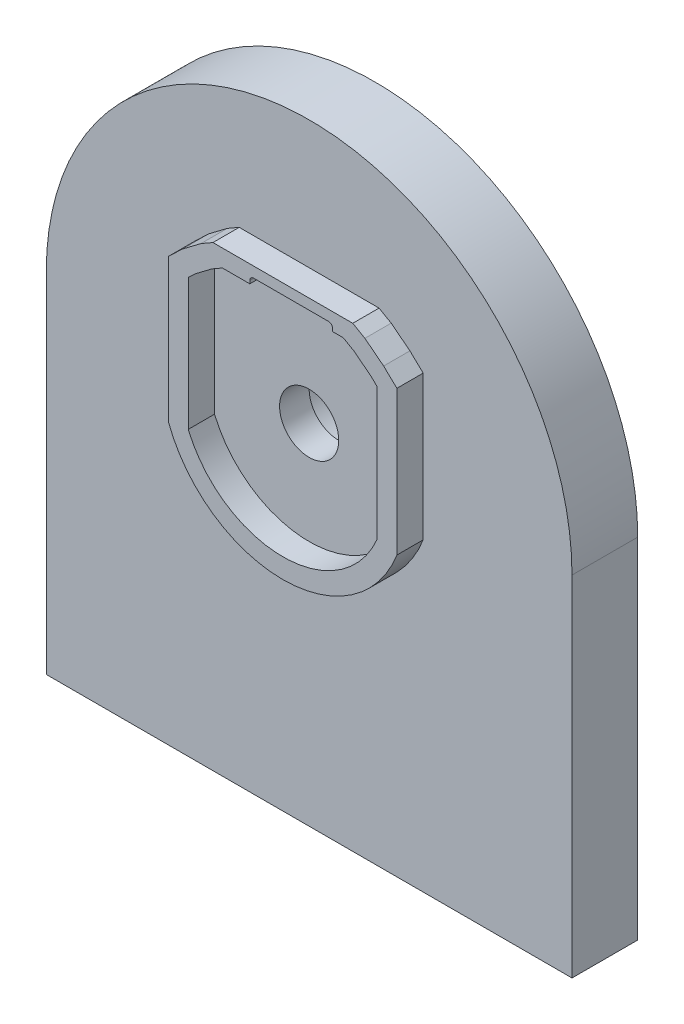
from build123d import *

# Parameters (mm, degrees)
SKETCH6_W           = 80
SKETCH6_H           = 106.2
BOSS_EXTRUDE3_DEPTH = 5
BOSS_EXTRUDE2_DEPTH = 4
CUT_EXTRUDE2_REACH  = 69.228
SKETCH4_R           = 4.5
SKETCH7_R           = 7.75
CUT_EXTRUDE3_DEPTH  = 5.5
CUT_EXTRUDE4_START  = -5
CUT_EXTRUDE4_DEPTH  = 10


with BuildPart() as part:
    # Sketch6 → Boss-Extrude3 (new, symmetric)
    with BuildSketch(Plane.XY):
        Rectangle(SKETCH6_W, SKETCH6_H)
    extrude(amount=BOSS_EXTRUDE3_DEPTH, both=True)

    # Sketch3 → Boss-Extrude2 (add)
    with BuildSketch(Plane.XY.offset(5)):
        with BuildLine():
            Line((-17.395287132, -6.571810208), (-17.395287132, 15.307157848))
            Line((-17.395287132, 15.307157848), (-15.311099774, 17.296395792))
            Line((-15.311099774, 17.296395792), (-12.46185448, 19.451424939))
            Line((-12.46185448, 19.451424939), (-10.63935497, 20.5))
            Line((-10.63935497, 20.5), (10.639354967, 20.5))
            Line((10.639354967, 20.5), (12.481546734, 19.440095002))
            Line((12.481546734, 19.440095002), (15.334663563, 17.215949154))
            Line((15.334663563, 17.215949154), (17.351649475, 15.287999429))
            Line((17.351649475, 15.287999429), (17.351649475, -6.686177108))
            ThreePointArc((17.351649475, -6.686177108), (-0.061204642, -18.595186415), (-17.395287132, -6.571810208))
        make_face()
        with BuildLine():
            Line((-14.395287132, -5.999057373), (-14.395287132, 14.02336094))
            Line((-14.395287132, 14.02336094), (-13.364210648, 15.007464628))
            Line((-13.364210648, 15.007464628), (-10.802429685, 16.945069879))
            Line((-10.802429685, 16.945069879), (-9.202356052, 17.865672216))
            Line((-9.202356052, 17.865672216), (-5.025287127, 17.865672216))
            Line((-5.025287127, 17.865672216), (-5.025287127, 18.307908255))
            ThreePointArc((-5.025287127, 18.307908255), (-4.850962964, 18.728764013), (-4.430107206, 18.903088176))
            Line((-4.430107206, 18.903088176), (6.970107208, 18.903088176))
            ThreePointArc((6.970107208, 18.903088176), (7.390962965, 18.728764013), (7.565287128, 18.307908255))
            Line((7.565287128, 18.307908255), (7.565287128, 17.865672216))
            Line((7.565287128, 17.865672216), (9.202356049, 17.865672216))
            Line((9.202356049, 17.865672216), (10.803064919, 16.944704398))
            Line((10.803064919, 16.944704398), (13.37101734, 14.942858327))
            Line((13.37101734, 14.942858327), (14.351649475, 14.00551442))
            Line((14.351649475, 14.00551442), (14.351649475, -6.102715652))
            ThreePointArc((14.351649475, -6.102715652), (-0.056234518, -15.595185752), (-14.395287132, -5.999057373))
        make_face(mode=Mode.SUBTRACT)
    extrude(amount=BOSS_EXTRUDE2_DEPTH)

    # Sketch4 → Cut-Extrude2 (cut, up to next)
    with BuildSketch(Plane.XY.offset(5), mode=Mode.PRIVATE) as cut_extrude2_sk1:
        Circle(SKETCH4_R)
    cut_extrude2_tool1 = extrude(cut_extrude2_sk1.sketch, amount=-CUT_EXTRUDE2_REACH, mode=Mode.PRIVATE) & part.part
    add(cut_extrude2_tool1.solids().sort_by_distance((0, 0, 5))[0], mode=Mode.SUBTRACT)

    # Sketch7 → Cut-Extrude3 (cut)
    with BuildSketch(Plane(origin=(0, 0, -5), x_dir=(-1, 0, 0), z_dir=(0, 0, -1))):
        Circle(SKETCH7_R)
    extrude(amount=-CUT_EXTRUDE3_DEPTH, mode=Mode.SUBTRACT)

    # Sketch8 → Cut-Extrude4 (cut)
    with BuildSketch(Plane.XY.offset(CUT_EXTRUDE4_START)):
        with BuildLine():
            Line((-40, 0), (-40, 53.1))
            Line((-40, 53.1), (40, 53.1))
            Line((40, 53.1), (40, 0))
            ThreePointArc((40, 0), (0, 40), (-40, 0))
        make_face()
    extrude(amount=CUT_EXTRUDE4_DEPTH, mode=Mode.SUBTRACT)


solid = part.part
